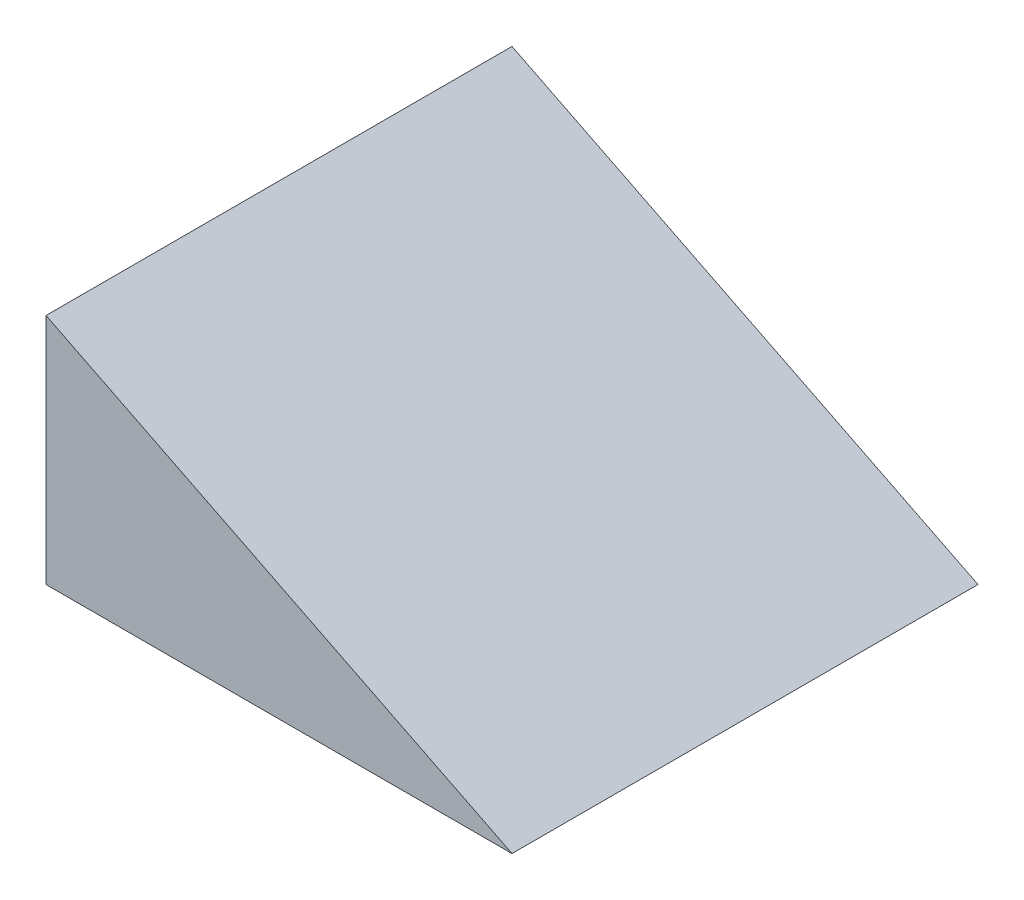
from build123d import *

# Parameters (mm, degrees)
BOSS_EXTRUDE1_DEPTH      = 12.7
BOSS_EXTRUDE1_DEPTH_BACK = 12.7


with BuildPart() as part:
    # Sketch1 → Boss-Extrude1 (new, two sides: drawn at the far end of the back side and taken through both)
    with BuildSketch(Plane.XY.offset(-BOSS_EXTRUDE1_DEPTH_BACK)):
        Polygon((0, 0), (25.4, 0), (0, 12.7), align=None)
    extrude(amount=BOSS_EXTRUDE1_DEPTH + BOSS_EXTRUDE1_DEPTH_BACK)


solid = part.part
